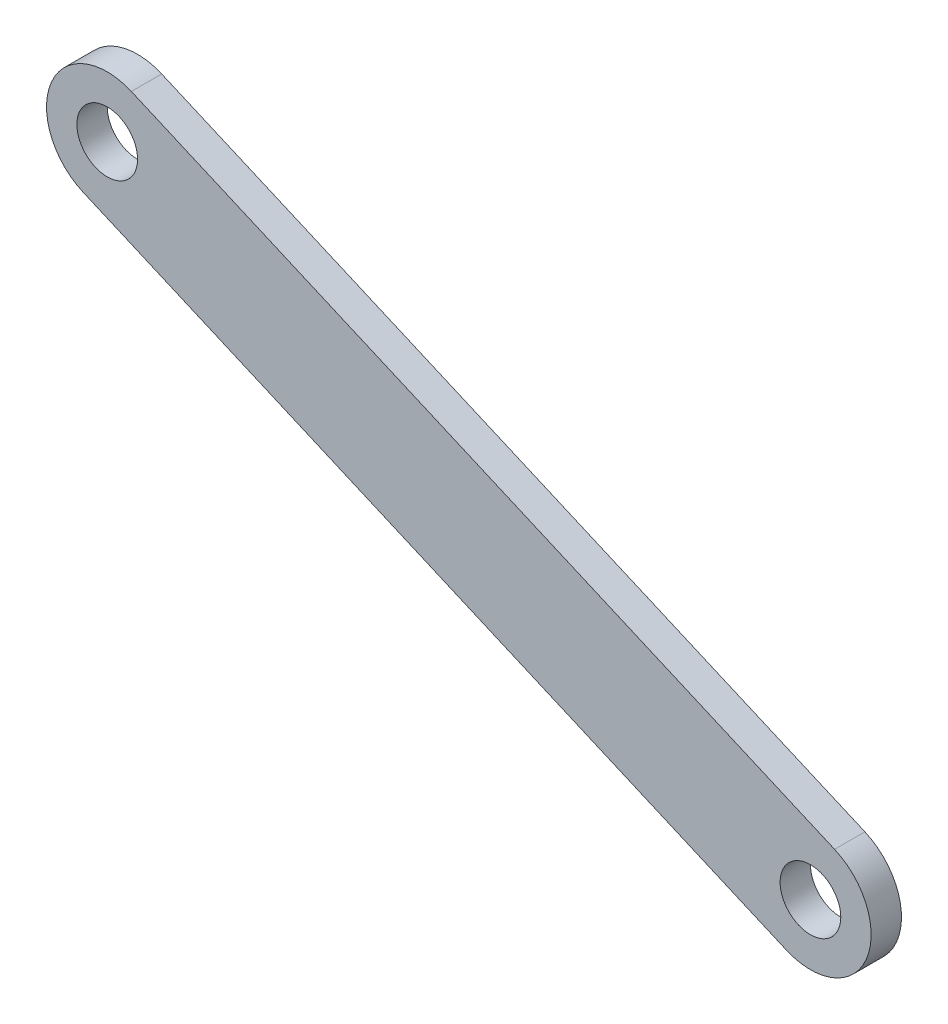
from build123d import *

# Parameters (mm, degrees)
SKETCH1_R           = 1.5875
BOSS_EXTRUDE1_DEPTH = 1.5875


with BuildPart() as part:
    # Sketch1 → Boss-Extrude1 (new body)
    with BuildSketch(Plane.XY):
        with BuildLine():
            Line((-73.532032079, 11.056439784), (-36.737666698, -4.886730422))
            ThreePointArc((-36.737666698, -4.886730422), (-35.086730422, -9.062333302), (-39.262333302, -10.713269578))
            Line((-39.262333302, -10.713269578), (-76.056698683, 5.229900628))
            ThreePointArc((-76.056698683, 5.229900628), (-77.707634959, 9.405503508), (-73.532032079, 11.056439784))
        make_face()
        with Locations((-38, -7.8)):
            Circle(SKETCH1_R, mode=Mode.SUBTRACT)
        with Locations((-74.794365381, 8.143170206)):
            Circle(SKETCH1_R, mode=Mode.SUBTRACT)
    extrude(amount=-BOSS_EXTRUDE1_DEPTH)


solid = part.part
